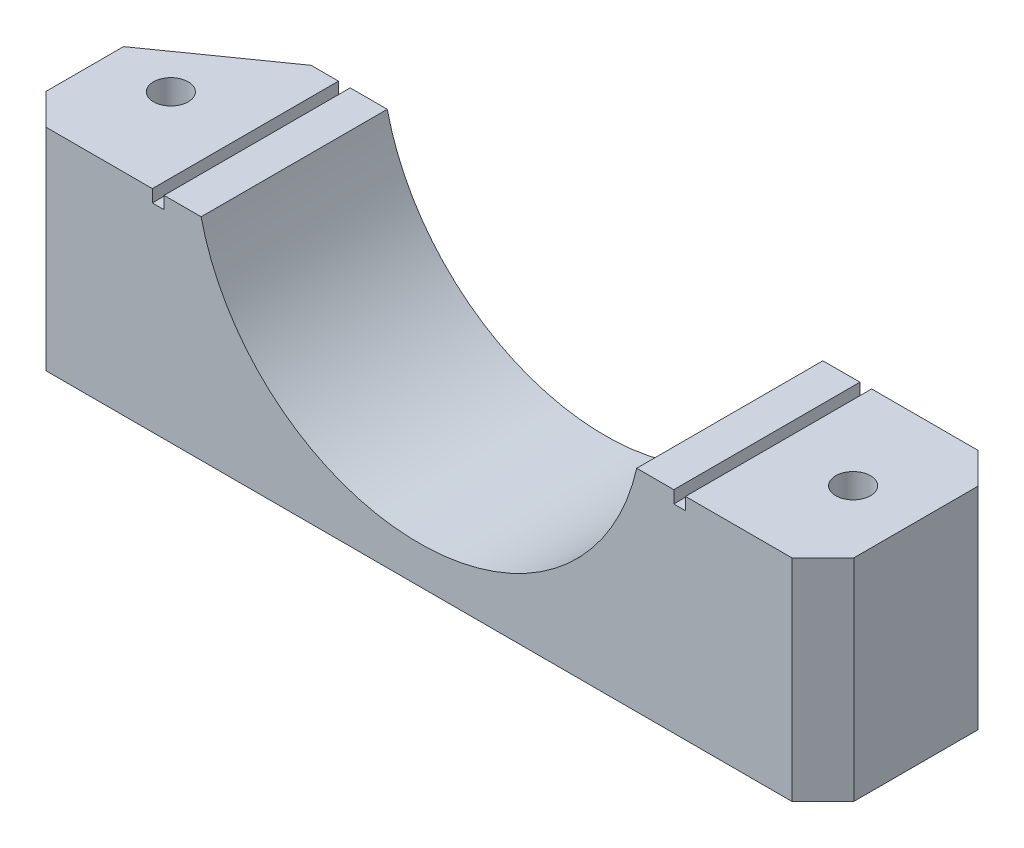
from build123d import *

# Parameters (mm, degrees)
BOSS_EXTRUDE1_DEPTH = 15
CHAMFER1_SIZE       = 2.5
SKETCH2_R           = 1.4
CUT_EXTRUDE1_DEPTH  = 40.667340007
SKETCH3_W           = 0.942684348
SKETCH3_H           = 15
CUT_EXTRUDE2_DEPTH  = 1
CUT_EXTRUDE3_DEPTH  = 25


with BuildPart() as part:
    # Sketch1 → Boss-Extrude1 (new body)
    with BuildSketch(Plane.XY):
        with BuildLine():
            Line((-17.549928775, -4), (-32.549928775, -4))
            Line((-32.549928775, -4), (-32.549928775, -21))
            Line((-32.549928775, -21), (32.549928775, -21))
            Line((32.549928775, -21), (32.549928775, -4))
            Line((32.549928775, -4), (17.549928775, -4))
            ThreePointArc((17.549928775, -4), (0, -18), (-17.549928775, -4))
        make_face()
    extrude(amount=BOSS_EXTRUDE1_DEPTH)

    # Chamfer1
    chamfer1_edges = [part.edges().sort_by_distance(p)[0] for p in [
        (-32.549928775, -12.5, 15),
        (32.549928775, -12.5, 15),
        (32.549928775, -12.5, 0),
    ]]
    chamfer(chamfer1_edges, length=CHAMFER1_SIZE)

    # Sketch2 → Cut-Extrude1 (cut, through all)
    with BuildSketch(Plane(origin=(0, -4, 0), x_dir=(1, 0, 0), z_dir=(0, 1, 0))):
        with Locations(Location((27.488644481, -7.5, 0), (0, 0, 180))):
            Circle(SKETCH2_R)
        with Locations((-27.488644481, -7.5)):
            Circle(SKETCH2_R)
    extrude(amount=-CUT_EXTRUDE1_DEPTH, mode=Mode.SUBTRACT)

    # Sketch3 → Cut-Extrude2 (cut)
    with BuildSketch(Plane(origin=(0, -4, 0), x_dir=(1, 0, 0), z_dir=(0, 1, 0))):
        with Locations((-21.008394031, -7.5)):
            Rectangle(SKETCH3_W, SKETCH3_H)
    cut_extrude2 = extrude(amount=-CUT_EXTRUDE2_DEPTH, mode=Mode.SUBTRACT)

    # Mirror1: Cut-Extrude2 across plane
    add(cut_extrude2.mirror(Plane(origin=(0, 0, 0), x_dir=(0, 0, 1), z_dir=(1, 0, 0))), mode=Mode.SUBTRACT)

    # Sketch4 → Cut-Extrude3 (cut)
    with BuildSketch(Plane.XZ.offset(21)):
        Polygon((-23.68309692, 0), (-32.549928775, 6.25), (-32.549928775, 0), align=None)
    extrude(amount=-CUT_EXTRUDE3_DEPTH, mode=Mode.SUBTRACT)


solid = part.part
